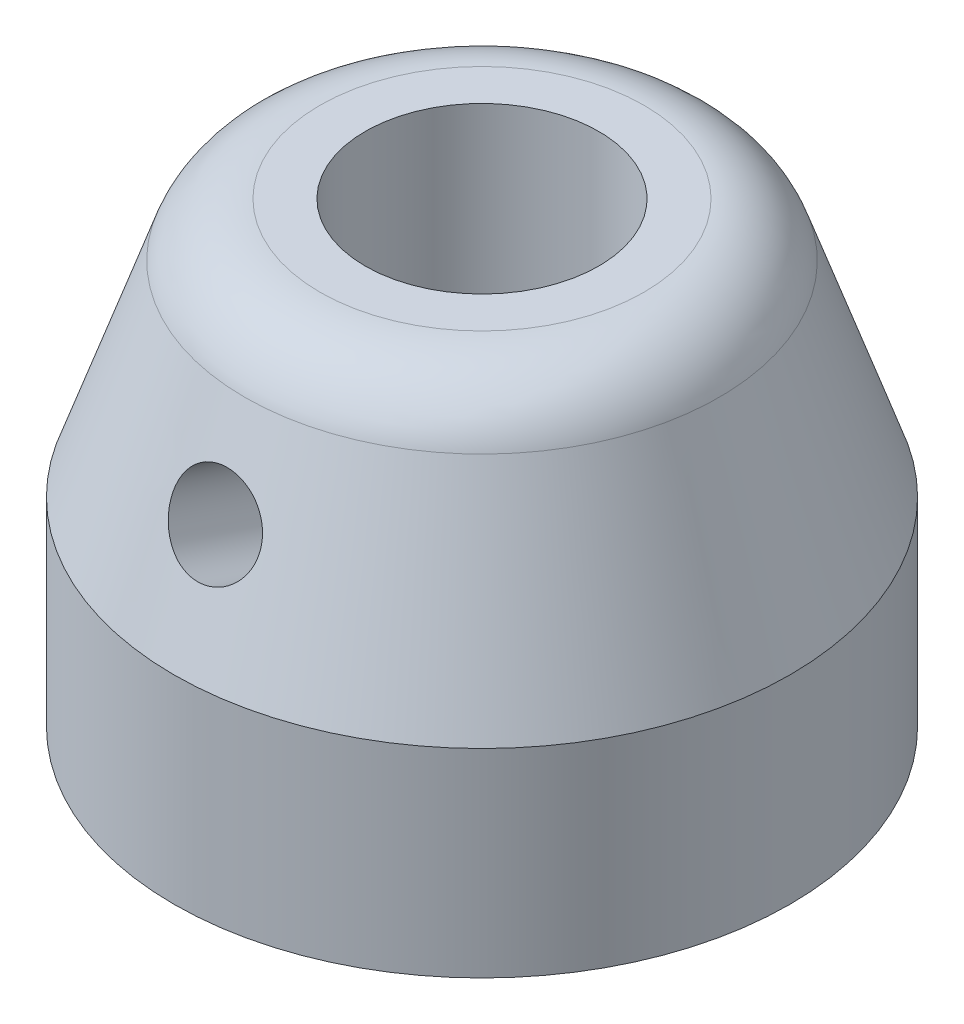
from build123d import *

# Parameters (mm, degrees)
M25X1_5_TAPPED_HOLE2_D     = 23.5
FILLET1_R                  = 8
M10X1_0_TAPPED_HOLE1_D     = 9
M10X1_0_TAPPED_HOLE1_DEPTH = 10
M10X1_0_TAPPED_HOLE1_TIP   = 2.703872786


with BuildPart() as part:
    # Sketch1 → Revolve1 (revolve)
    with BuildSketch(Plane.XY, mode=Mode.PRIVATE) as revolve1_sk:
        Polygon((0, 12.478494624), (22, 12.478494624), (31, -13.521505376), (31, -33.521505376), (0, -33.521505376), align=None)
    revolve(revolve1_sk.sketch.rotate(Axis((0, 17.682795699, 0), (0, -1, 0)), 90), axis=Axis((0, 17.682795699, 0), (0, -1, 0)))

    # M25x1.5 Tapped Hole2 (through all)
    with Locations(Plane(origin=(0, 12.478494624, 0), x_dir=(1, 0, 0), z_dir=(0, 1, 0))):
        with Locations((0, 0)):
            Hole(M25X1_5_TAPPED_HOLE2_D / 2)

    # Fillet1
    fillet1_edges = [part.edges().sort_by_distance(p)[0] for p in [
        (0, 12.478494624, -22),
    ]]
    fillet(fillet1_edges, radius=FILLET1_R)

    # M10x1.0 Tapped Hole1
    with Locations(Plane(origin=(0, 8.13574381, 23.503259897), x_dir=(1, 0, 0), z_dir=(0, 0.32711056388316645, 0.9449860734402581))):
        with Locations((0, -11.100931225)):
            Hole(M10X1_0_TAPPED_HOLE1_D / 2, depth=M10X1_0_TAPPED_HOLE1_DEPTH)
            with Locations((0, 0, -(M10X1_0_TAPPED_HOLE1_DEPTH + M10X1_0_TAPPED_HOLE1_TIP / 2))):  # 118° drill point
                Cone(0, M10X1_0_TAPPED_HOLE1_D / 2, M10X1_0_TAPPED_HOLE1_TIP, mode=Mode.SUBTRACT)


solid = part.part
